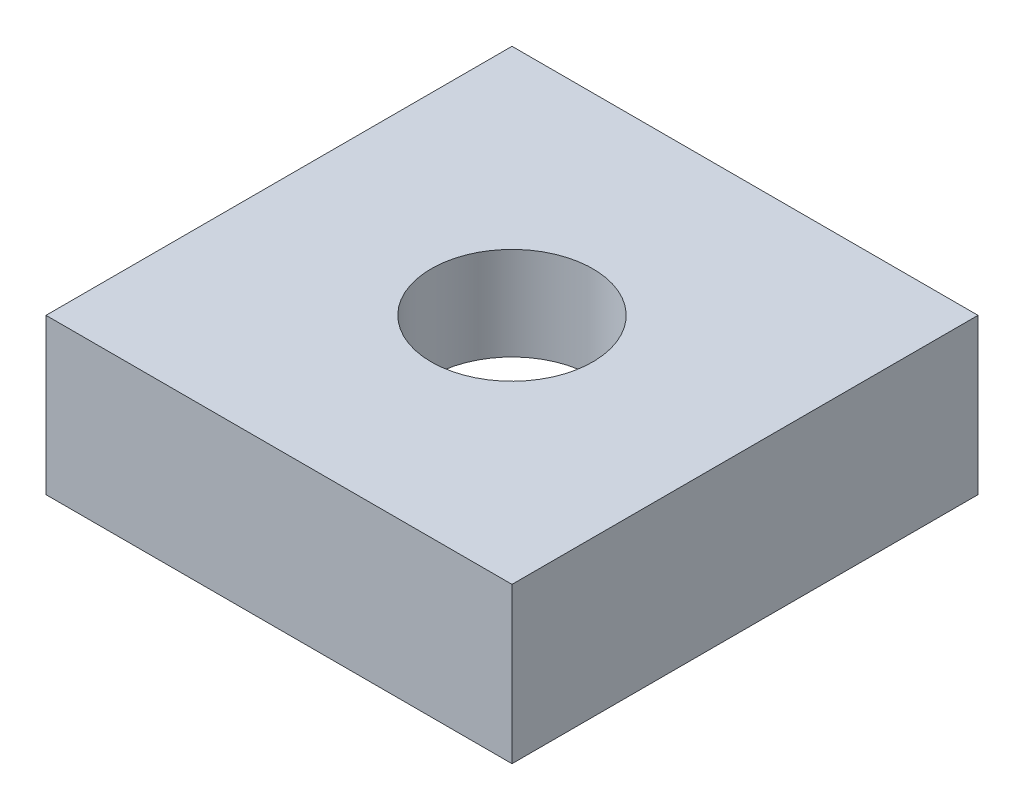
from build123d import *

# Parameters (mm, degrees)
CROQUIS1_W              = 15
CROQUIS1_H              = 15
SALIENTE_EXTRUIR1_DEPTH = 5
CROQUIS2_R              = 2.6
CORTAR_EXTRUIR1_DEPTH   = 5
CROQUIS3_W              = 12.5
CROQUIS3_H              = 12.5
CORTAR_EXTRUIR2_DEPTH   = 2


with BuildPart() as part:
    # Croquis1 → Saliente-Extruir1 (new body)
    with BuildSketch(Plane(origin=(0, 0, 0), x_dir=(1, 0, 0), z_dir=(0, 1, 0))):
        with Locations((7.5, 7.5)):
            Rectangle(CROQUIS1_W, CROQUIS1_H)
    extrude(amount=SALIENTE_EXTRUIR1_DEPTH)

    # Croquis2 → Cortar-Extruir1 (cut)
    with BuildSketch(Plane(origin=(0, 5, 0), x_dir=(1, 0, 0), z_dir=(0, 1, 0))):
        with Locations(Location((7.5, 7.5, 0), (0, 0, 270))):
            Circle(CROQUIS2_R)
    extrude(amount=-CORTAR_EXTRUIR1_DEPTH, mode=Mode.SUBTRACT)

    # Croquis3 → Cortar-Extruir2 (cut)
    with BuildSketch(Plane.XZ):
        with Locations((6.25, -8.75)):
            Rectangle(CROQUIS3_W, CROQUIS3_H)
    extrude(amount=-CORTAR_EXTRUIR2_DEPTH, mode=Mode.SUBTRACT)


solid = part.part
